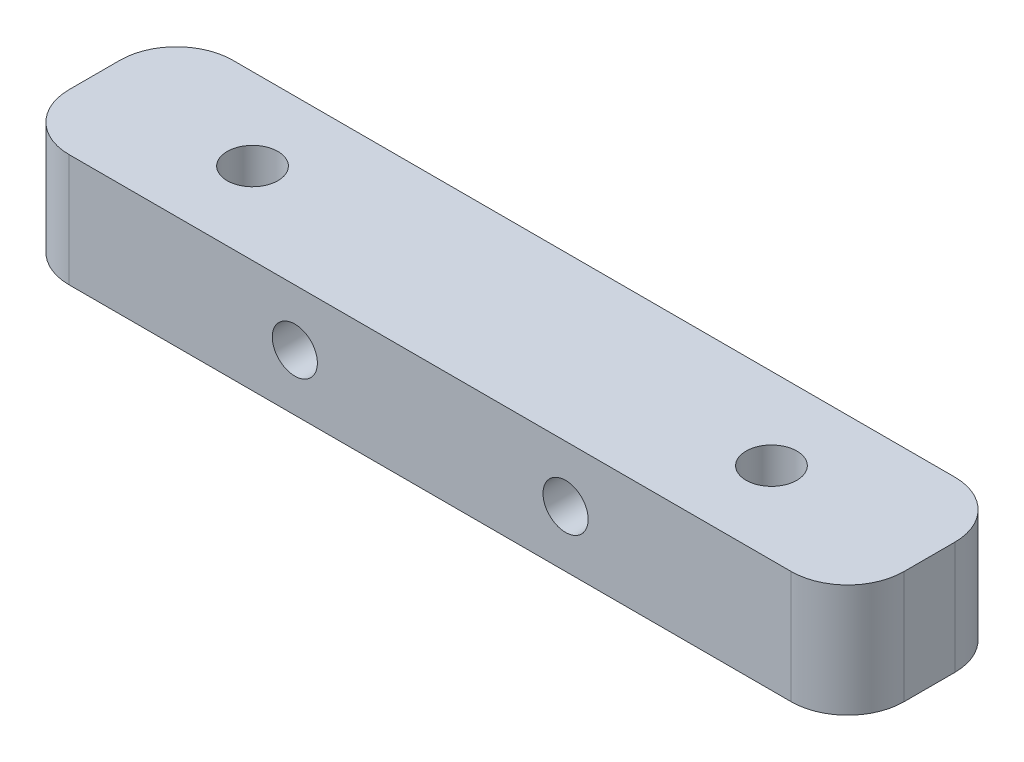
from build123d import *

# Parameters (mm, degrees)
SKETCH1_R           = 2.25
BOSS_EXTRUDE1_DEPTH = 10
FILLET1_R           = 5
SKETCH2_R           = 2
CUT_EXTRUDE1_DEPTH  = 24


with BuildPart() as part:
    # Sketch1 → Boss-Extrude1 (new body)
    with BuildSketch(Plane(origin=(0, 0, 0), x_dir=(1, 0, 0), z_dir=(0, 1, 0))):
        with BuildLine():
            Line((32, 7.25), (-32, 7.25))
            ThreePointArc((-32, 7.25), (-35.535533906, 5.785533906), (-37, 2.25))
            Line((-37, 2.25), (-37, -7.25))
            Line((-37, -7.25), (37, -7.25))
            Line((37, -7.25), (37, 2.25))
            ThreePointArc((37, 2.25), (35.535533906, 5.785533906), (32, 7.25))
        make_face()
        with Locations(Location((23, 0, 0), (0, 0, 270))):
            Circle(SKETCH1_R, mode=Mode.SUBTRACT)
        with Locations(Location((-23, 0, 0), (0, 0, 270))):
            Circle(SKETCH1_R, mode=Mode.SUBTRACT)
    extrude(amount=BOSS_EXTRUDE1_DEPTH)

    # Fillet1
    fillet1_edges = [part.edges().sort_by_distance(p)[0] for p in [
        (37, 5, 7.25),
        (-37, 5, 7.25),
    ]]
    fillet(fillet1_edges, radius=FILLET1_R)

    # Sketch2 → Cut-Extrude1 (cut)
    with BuildSketch(Plane(origin=(0, 0, -7.25), x_dir=(-1, 0, 0), z_dir=(0, 0, -1))):
        with Locations((-12, 5)):
            Circle(SKETCH2_R)
        with Locations((12, 5)):
            Circle(SKETCH2_R)
    extrude(amount=-CUT_EXTRUDE1_DEPTH, mode=Mode.SUBTRACT)


solid = part.part
